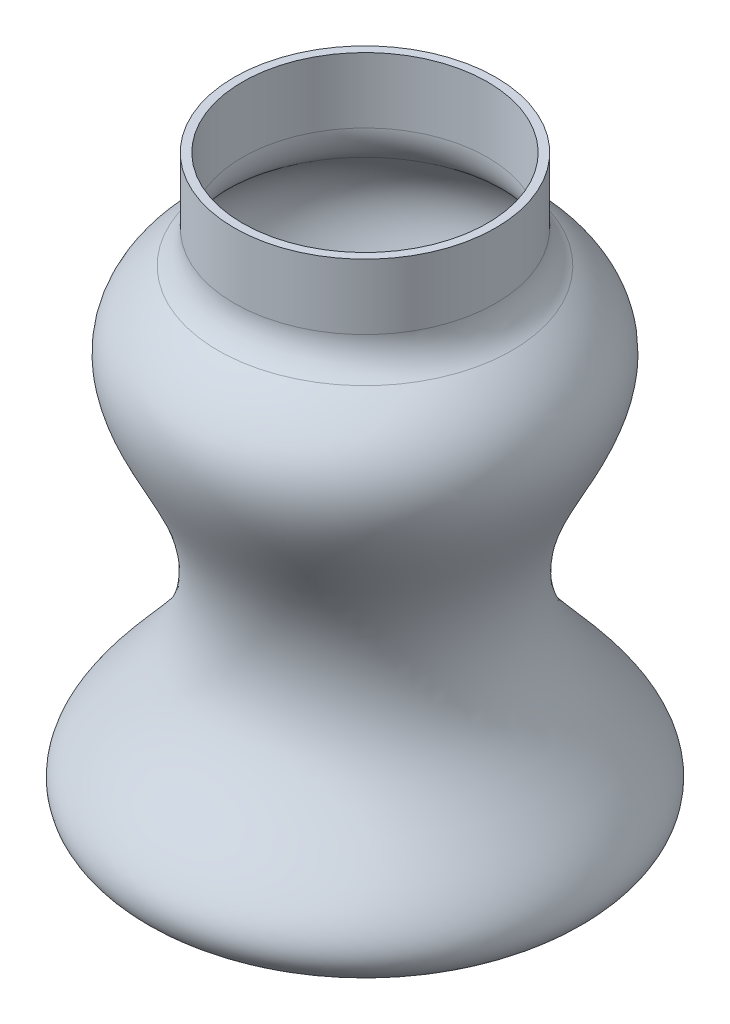
from build123d import *

# Parameters (mm, degrees)
THICKEN1_T2 = 1


with BuildPart() as body_1:
    # Surface-Revolve1: a surface, the sketch's curves turned about an axis
    with BuildLine(Plane.XY, mode=Mode.PRIVATE) as surface_revolve1_1_path:
        Line((16, 71), (16, 63))
        ThreePointArc((16, 63), (16.527864045, 60.763932023), (18, 59))
        add(Edge.make_bspline(
            [(18, 59), (24.037262957, 54.472052783), (24.578576157, 46.087028385), (16.032144941, 33.876266262), (14.745913493, 15.308393024), (34.414826042, 4.466953112), (22.5, 0)],
            knots=[0, 0, 0, 0, 0.205664951, 0.400580199, 0.622191459, 0.978911642, 0.978911642, 0.978911642, 0.978911642], degree=3))
        Line((22.5, 0), (20, 0))
        ThreePointArc((20, 0), (10.229610025, 3.148050125), (0, 4))
    surface_revolve1_1 = Shell.revolve(surface_revolve1_1_path.wire(), 360, Axis((0, 0, 0), (0, -1, 0)))
    add(Solid.thicken(surface_revolve1_1, -THICKEN1_T2))


solid = body_1.part
